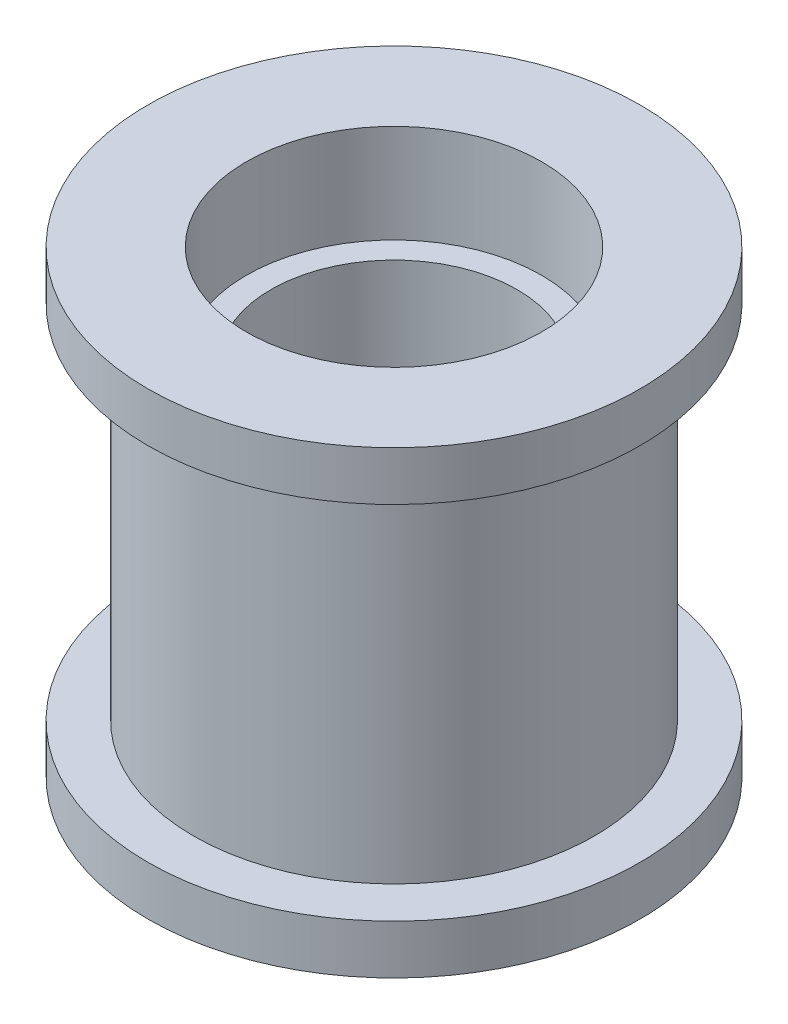
from build123d import *


with BuildPart() as part:
    # Sketch1 → Revolve1 (revolve)
    with BuildSketch(Plane.XY, mode=Mode.PRIVATE) as revolve1_sk:
        Polygon((-4.5, 0), (-4.5, 3), (-3.75, 3), (-3.75, 11), (-4.5, 11), (-4.5, 14), (-7.5, 14), (-7.5, 12.5), (-6.11, 12.5), (-6.11, 1.5), (-7.5, 1.5), (-7.5, 0), align=None)
    revolve(revolve1_sk.sketch.rotate(Axis((0, 0, 0), (0, 1, 0)), 270), axis=Axis((0, 0, 0), (0, 1, 0)))


solid = part.part
